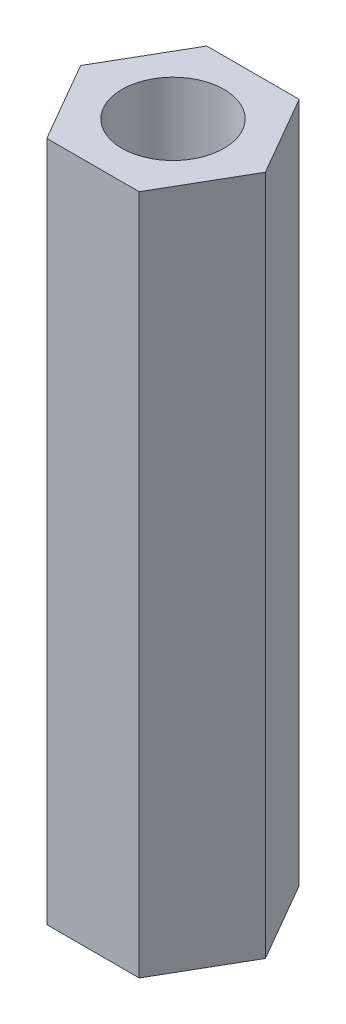
from build123d import *

# Parameters (mm, degrees)
SKETCH1_R           = 1.5
BOSS_EXTRUDE1_DEPTH = 20


with BuildPart() as part:
    # Sketch1 → Boss-Extrude1 (new body)
    with BuildSketch(Plane(origin=(0, 0, 0), x_dir=(1, 0, 0), z_dir=(0, 1, 0))):
        Polygon((2.713546265, 0), (1.356773133, 2.35), (-1.356773133, 2.35), (-2.713546265, 0), (-1.356773133, -2.35), (1.356773133, -2.35), align=None)
        with Locations(Location((0, 0, 0), (0, 0, 270))):
            Circle(SKETCH1_R, mode=Mode.SUBTRACT)
    extrude(amount=BOSS_EXTRUDE1_DEPTH)


solid = part.part
